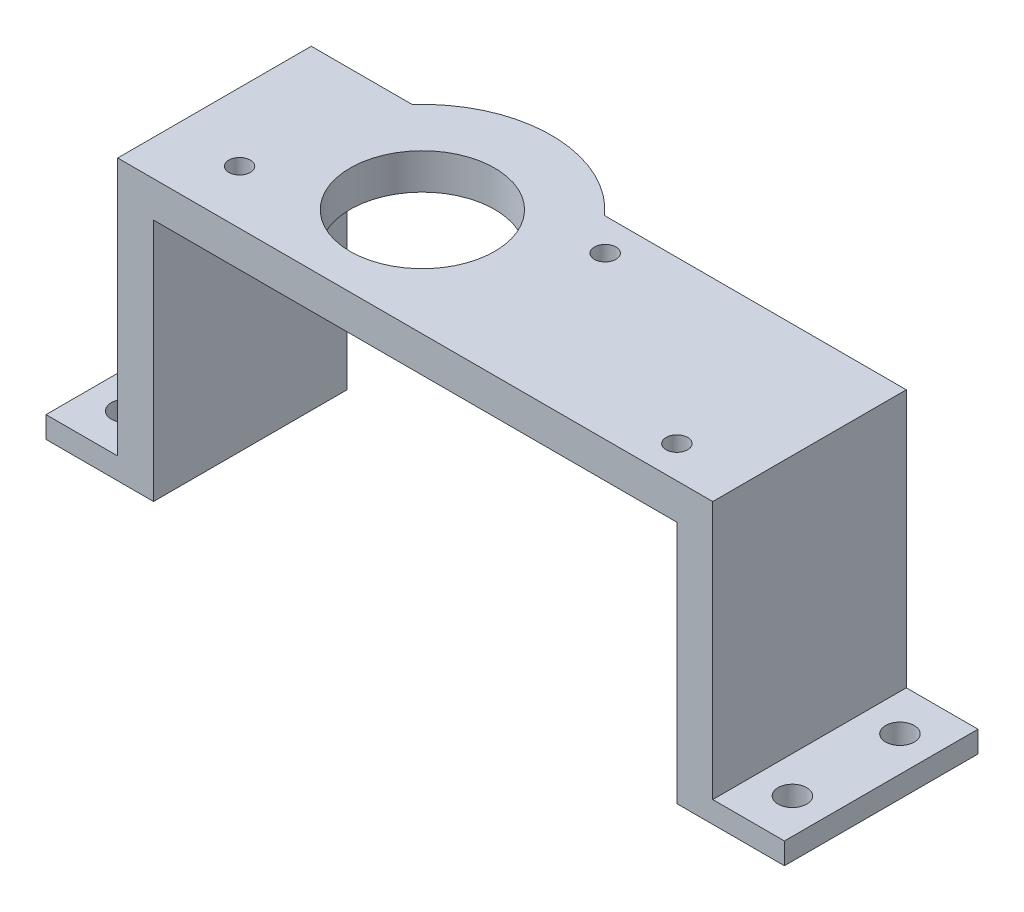
from build123d import *

# Parameters (mm, degrees)
SKETCH1_R           = 1.5
SKETCH1_R_2         = 10.079418918
BOSS_EXTRUDE1_DEPTH = 5
SKETCH2_W           = 5
SKETCH2_H           = 27
BOSS_EXTRUDE2_DEPTH = 39
SKETCH3_W           = 10
SKETCH3_H           = 27
SKETCH3_R           = 2
BOSS_EXTRUDE3_DEPTH = 3


with BuildPart() as part:
    # Sketch1 → Boss-Extrude1 (new body)
    with BuildSketch(Plane(origin=(0, 0, 0), x_dir=(1, 0, 0), z_dir=(0, 1, 0))):
        with BuildLine():
            Line((41.602990033, 18.779069767), (4.519397898, 18.779069767))
            ThreePointArc((4.519397898, 18.779069767), (-8.897009967, 24.779069767), (-22.313417832, 18.779069767))
            Line((-22.313417832, 18.779069767), (-31.397009967, 18.779069767))
            Line((-31.397009967, 18.779069767), (-31.397009967, -8.220930233))
            Line((-31.397009967, -8.220930233), (41.602990033, -8.220930233))
            Line((41.602990033, -8.220930233), (41.602990033, 18.779069767))
        make_face()
        with BuildLine():
            ThreePointArc((-23.542908001, -3.720930233), (-23.535781037, -3.712942946), (-23.528673093, -3.704938729))
            ThreePointArc((-23.528673093, -3.704938729), (-23.522939474, -3.712936049), (-23.517201484, -3.720930233))
            Line((-23.517201484, -3.720930233), (-23.542908001, -3.720930233))
        make_face(mode=Mode.SUBTRACT)
        with Locations(Location((-26.897009967, -0.720930233, 0), (0, 0, 270))):
            Circle(SKETCH1_R, mode=Mode.SUBTRACT)
        with Locations(Location((37.102990033, -3.720930233, 0), (0, 0, 270))):
            Circle(SKETCH1_R, mode=Mode.SUBTRACT)
        with Locations(Location((-8.897009967, 6.779069767, 0), (0, 0, 270))):
            Circle(SKETCH1_R_2, mode=Mode.SUBTRACT)
        with Locations(Location((9.102990033, 14.279069767, 0), (0, 0, 270))):
            Circle(SKETCH1_R, mode=Mode.SUBTRACT)
    extrude(amount=BOSS_EXTRUDE1_DEPTH)

    # Sketch2 → Boss-Extrude2 (add)
    with BuildSketch(Plane(origin=(0, 5, 0), x_dir=(1, 0, 0), z_dir=(0, 1, 0))):
        with Locations((-33.897009967, 5.279069767)):
            Rectangle(SKETCH2_W, SKETCH2_H)
        with Locations((44.102990033, 5.279069767)):
            Rectangle(SKETCH2_W, SKETCH2_H)
    extrude(amount=-BOSS_EXTRUDE2_DEPTH)

    # Sketch3 → Boss-Extrude3 (add)
    # profile 1 of 2: a face of its own
    with BuildSketch(Plane.XZ.offset(34)):
        with Locations((51.602990033, -5.279069767)):
            Rectangle(SKETCH3_W, SKETCH3_H)
        with Locations(Location((51.715372218, 2.220930233, 0), (0, 0, 270))):
            Circle(SKETCH3_R, mode=Mode.SUBTRACT)
        with Locations(Location((51.715372218, -12.779069767, 0), (0, 0, 270))):
            Circle(SKETCH3_R, mode=Mode.SUBTRACT)
    # profile 2 of 2: a face of its own
    with BuildSketch(Plane.XZ.offset(34)):
        with Locations((-41.397009967, -5.279069767)):
            Rectangle(SKETCH3_W, SKETCH3_H)
        with Locations(Location((-41.284627782, 2.220930233, 0), (0, 0, 270))):
            Circle(SKETCH3_R, mode=Mode.SUBTRACT)
        with Locations(Location((-41.284627782, -12.779069767, 0), (0, 0, 270))):
            Circle(SKETCH3_R, mode=Mode.SUBTRACT)
    extrude(amount=-BOSS_EXTRUDE3_DEPTH)


solid = part.part
